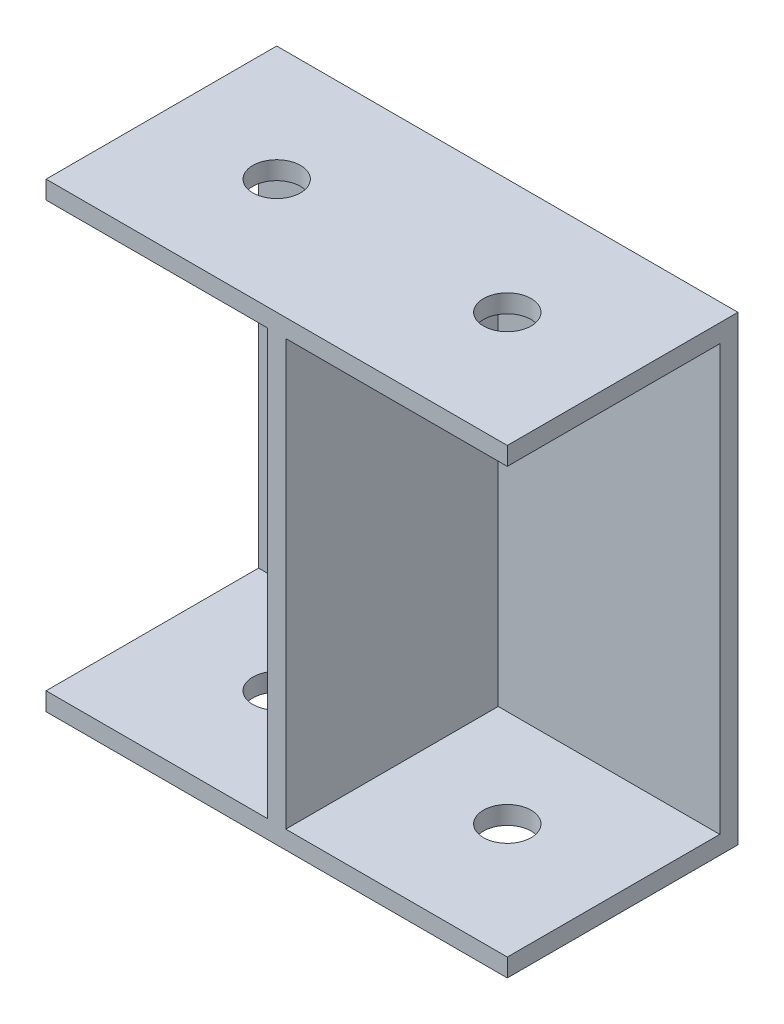
from build123d import *

# Parameters (mm, degrees)
SKETCH1_W           = 76.2
SKETCH1_H           = 76.2
BOSS_EXTRUDE1_DEPTH = 38.1
SKETCH3_W           = 39.463440316
SKETCH3_H           = 70.199999808
SKETCH3_W_2         = 39.34827811
CUT_EXTRUDE1_DEPTH  = 35.100000006
SKETCH4_R           = 3.937
CUT_EXTRUDE2_DEPTH  = 38.1


with BuildPart() as part:
    # Sketch1 → Boss-Extrude1 (new body)
    with BuildSketch(Plane.XY):
        Rectangle(SKETCH1_W, SKETCH1_H)
    extrude(amount=BOSS_EXTRUDE1_DEPTH)

    # Sketch3 → Cut-Extrude1 (cut)
    with BuildSketch(Plane.XY.offset(38.1)):
        with Locations((21.231720251, 0)):
            Rectangle(SKETCH3_W, SKETCH3_H)
        with Locations((-21.174138956, 0)):
            Rectangle(SKETCH3_W_2, SKETCH3_H)
    extrude(amount=-CUT_EXTRUDE1_DEPTH, mode=Mode.SUBTRACT)

    # Sketch4 → Cut-Extrude2 (cut, symmetric)
    with BuildSketch(Plane(origin=(0, 0, 0), x_dir=(1, 0, 0), z_dir=(0, 1, 0))):
        with Locations(Location((19.05, -19.05, 0), (0, 0, 270))):
            Circle(SKETCH4_R)
        with Locations(Location((-19.05, -19.05, 0), (0, 0, 270))):
            Circle(SKETCH4_R)
    extrude(amount=CUT_EXTRUDE2_DEPTH, both=True, mode=Mode.SUBTRACT)


solid = part.part
